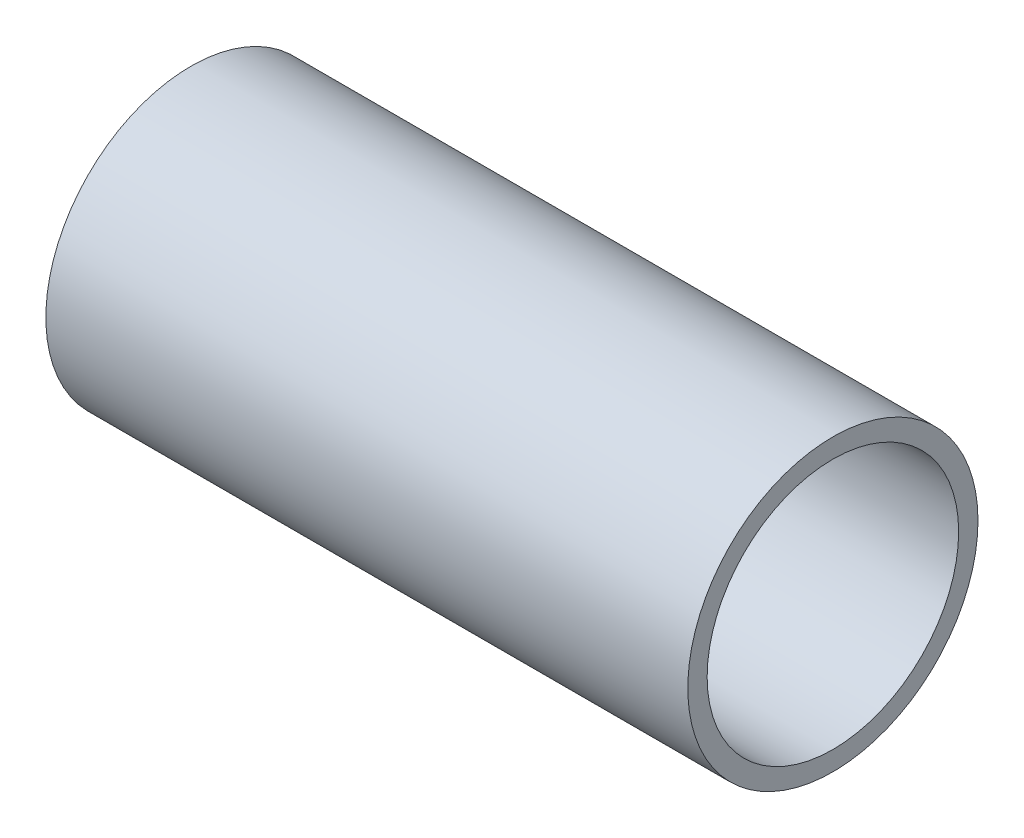
from build123d import *

# Parameters (mm, degrees)
ESQUISSE1_R        = 16.5
ESQUISSE1_R_2      = 14.3
BOSS_EXTRU_1_DEPTH = 36.5


with BuildPart() as part:
    # Esquisse1 → Boss.-Extru.1 (new, symmetric)
    with BuildSketch(Plane(origin=(0, 0, 0), x_dir=(0, 0, -1), z_dir=(1, 0, 0))):
        Circle(ESQUISSE1_R)
        Circle(ESQUISSE1_R_2, mode=Mode.SUBTRACT)
    extrude(amount=BOSS_EXTRU_1_DEPTH, both=True)


solid = part.part
